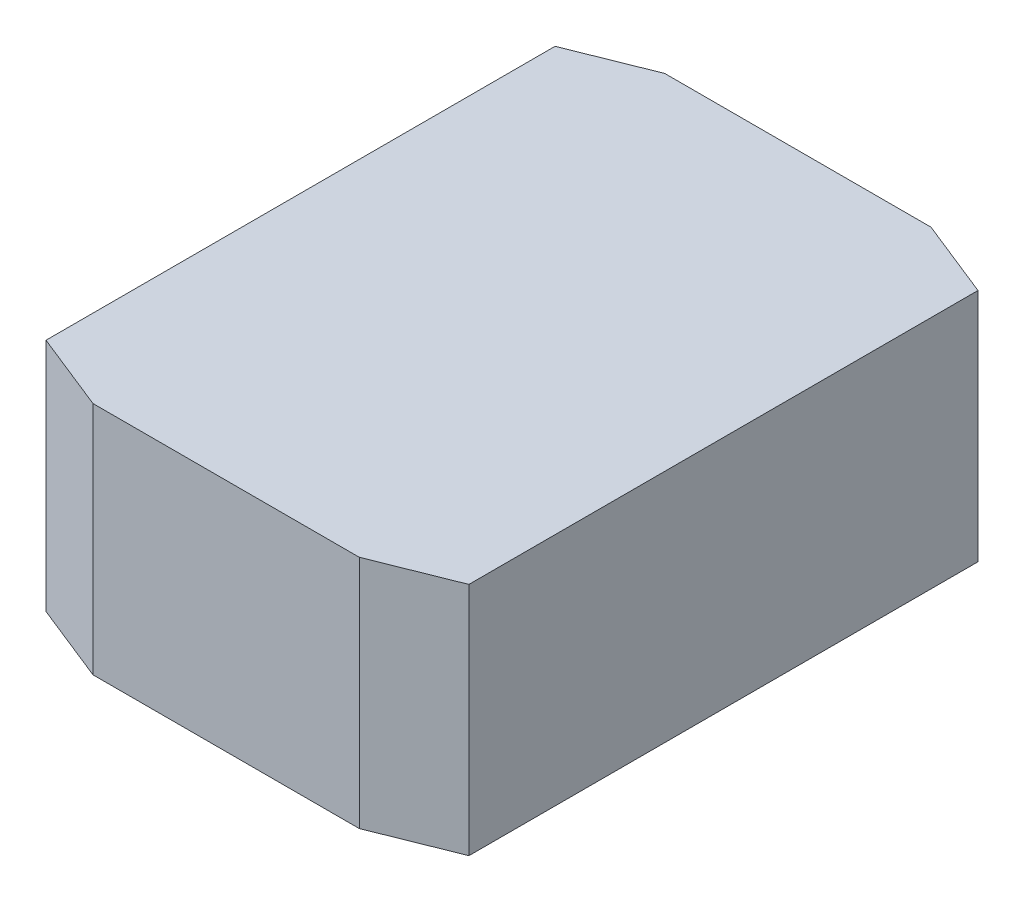
from build123d import *

# Parameters (mm, degrees)
SCHIZZO2_W                   = 2700
SCHIZZO2_H                   = 3650
ESTRUSIONE_ESTRUSIONE1_DEPTH = 1500
TAGLIO_ESTRUSIONE1_DEPTH     = 2721.868427543
SPECCHIA2_COPY_1_DEPTH       = 2721.868427543
SPECCHIA2_COPY_2_DEPTH       = 2721.868427543
SPECCHIA2_COPY_3_DEPTH       = 2721.868427543
SCHIZZO5_R                   = 500
SCHIZZO5_R_2                 = 450
ESTRUSIONE_ESTRUSIONE3_DEPTH = 300


with BuildPart() as part:
    # Schizzo2 → Estrusione-Estrusione1 (new body)
    with BuildSketch(Plane(origin=(0, 0, 0), x_dir=(1, 0, 0), z_dir=(0, 1, 0))):
        Rectangle(SCHIZZO2_W, SCHIZZO2_H)
    extrude(amount=ESTRUSIONE_ESTRUSIONE1_DEPTH)

    # Schizzo3 → Taglio-Estrusione1 (cut, through all)
    with BuildSketch(Plane(origin=(0, 1500, 0), x_dir=(1, 0, 0), z_dir=(0, 1, 0))):
        Polygon((-1350, 1825), (-1350, 1625), (-850, 1825), align=None)
    taglio_estrusione1 = extrude(amount=-TAGLIO_ESTRUSIONE1_DEPTH, mode=Mode.SUBTRACT)

    # Specchia1: Taglio-Estrusione1 across plane
    add(taglio_estrusione1.mirror(Plane.XY), mode=Mode.SUBTRACT)

    # Specchia1 at the second plane: Taglio-Estrusione1 across plane
    add(taglio_estrusione1.mirror(Plane.ZX), mode=Mode.SUBTRACT)

    # Specchia2 copy 1 sketch → Specchia2 copy 1 (cut, through all)
    with BuildSketch(Plane(origin=(0, 1500, 0), x_dir=(-1, 0, 0), z_dir=(0, 1, 0))):
        Polygon((-1350, 1825), (-1350, 1625), (-850, 1825), align=None)
    extrude(amount=-SPECCHIA2_COPY_1_DEPTH, mode=Mode.SUBTRACT)

    # Specchia2 copy 2 sketch → Specchia2 copy 2 (cut, through all)
    with BuildSketch(Plane(origin=(0, -1500, 0), x_dir=(-1, 0, 0), z_dir=(0, -1, 0))):
        Polygon((-1350, 1825), (-1350, 1625), (-850, 1825), align=None)
    extrude(amount=-SPECCHIA2_COPY_2_DEPTH, mode=Mode.SUBTRACT)

    # Specchia2 copy 3 sketch → Specchia2 copy 3 (cut, through all)
    with BuildSketch(Plane(origin=(0, 1500, 0), x_dir=(-1, 0, 0), z_dir=(0, 1, 0))):
        Polygon((-1350, -1825), (-1350, -1625), (-850, -1825), align=None)
    extrude(amount=-SPECCHIA2_COPY_3_DEPTH, mode=Mode.SUBTRACT)

    # Schizzo5 → Estrusione-Estrusione3 (add)
    with BuildSketch(Plane.XZ):
        with Locations(Location((0, 0, 0), (0, 0, 270))):
            Circle(SCHIZZO5_R)
        with Locations(Location((0, 0, 0), (0, 0, 270))):
            Circle(SCHIZZO5_R_2, mode=Mode.SUBTRACT)
    extrude(amount=ESTRUSIONE_ESTRUSIONE3_DEPTH)


solid = part.part
